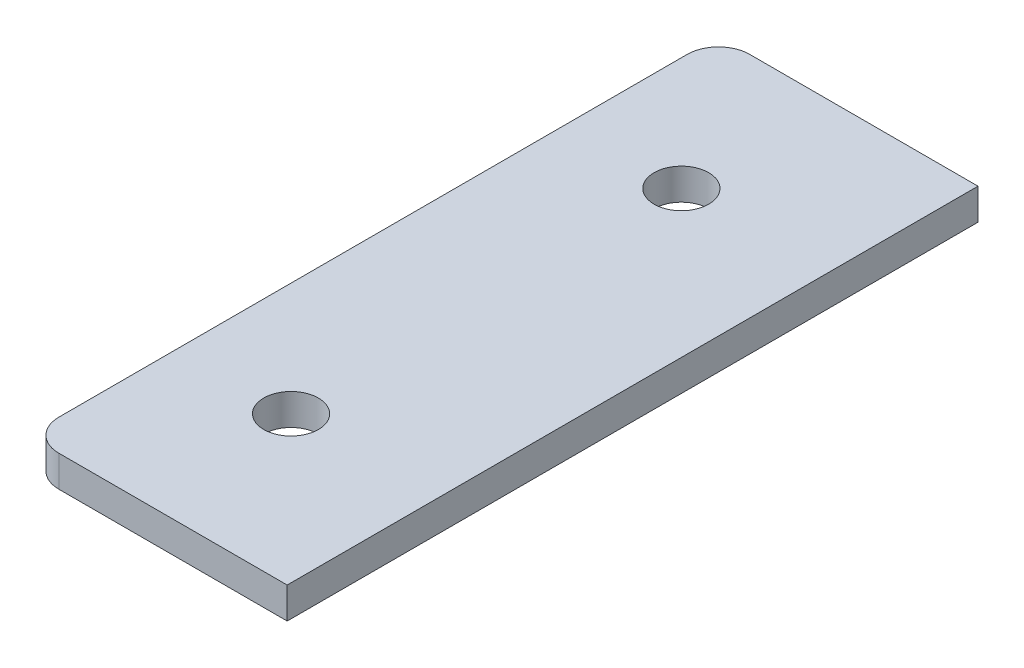
from build123d import *

# Parameters (mm, degrees)
SKETCH1_R           = 7
BOSS_EXTRUDE1_DEPTH = 8


with BuildPart() as part:
    # Sketch1 → Boss-Extrude1 (new body)
    with BuildSketch(Plane(origin=(0, 0, 0), x_dir=(1, 0, 0), z_dir=(0, 1, 0))):
        with BuildLine():
            Line((45.232378219, 82.321586231), (45.232378219, -94.678413769))
            Line((45.232378219, -94.678413769), (-13.267621781, -94.678413769))
            ThreePointArc((-13.267621781, -94.678413769), (-18.924476031, -92.335268019), (-21.267621781, -86.678413769))
            Line((-21.267621781, -86.678413769), (-21.267621781, 74.321586231))
            ThreePointArc((-21.267621781, 74.321586231), (-18.924476031, 79.97844048), (-13.267621781, 82.321586231))
            Line((-13.267621781, 82.321586231), (45.232378219, 82.321586231))
        make_face()
        with Locations(Location((7.732378219, -56.178413769, 0), (0, 0, 270))):
            Circle(SKETCH1_R, mode=Mode.SUBTRACT)
        with Locations(Location((7.732378219, 43.821586231, 0), (0, 0, 270))):
            Circle(SKETCH1_R, mode=Mode.SUBTRACT)
    extrude(amount=BOSS_EXTRUDE1_DEPTH)


solid = part.part
